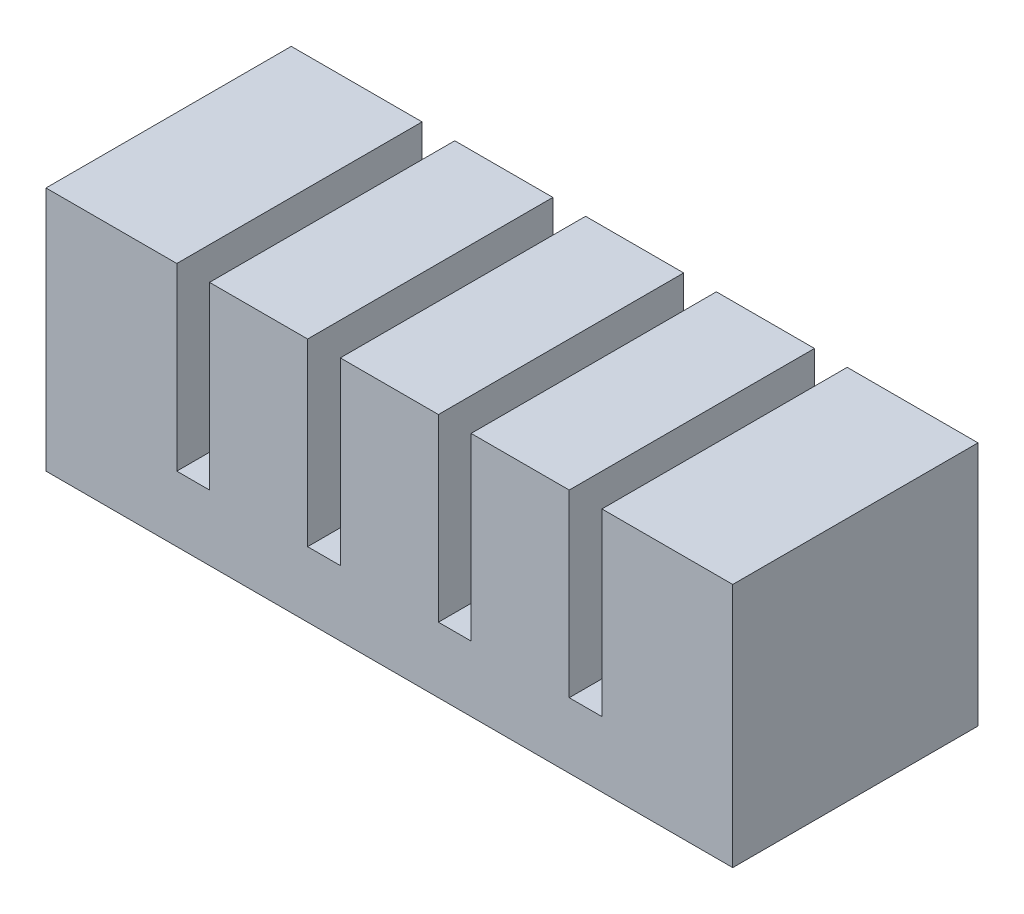
from build123d import *

# Parameters (mm, degrees)
SKETCH1_W           = 6
SKETCH1_H           = 15
BOSS_EXTRUDE1_DEPTH = 15
SKETCH2_W           = 4
SKETCH2_H           = 11
CUT_EXTRUDE1_DEPTH  = 13
SKETCH3_W           = 15
SKETCH3_H           = 4
BOSS_EXTRUDE2_DEPTH = 2
LPATTERN1_COUNT     = 4
LPATTERN1_PITCH     = 8
SKETCH4_W           = 15
SKETCH4_H           = 15
BOSS_EXTRUDE3_DEPTH = 8
SKETCH5_W           = 4
SKETCH5_H           = 11
CUT_EXTRUDE2_DEPTH  = 5.5
SKETCH6_W           = 15
SKETCH6_H           = 15
BOSS_EXTRUDE4_DEPTH = 2
SKETCH7_W           = 36
SKETCH7_H           = 2
CUT_EXTRUDE3_DEPTH  = 2


with BuildPart() as part:
    # Sketch1 → Boss-Extrude1 (new body)
    with BuildSketch(Plane(origin=(0, 0, 0), x_dir=(1, 0, 0), z_dir=(0, 1, 0))):
        with Locations((3, 7.5)):
            Rectangle(SKETCH1_W, SKETCH1_H)
    extrude(amount=BOSS_EXTRUDE1_DEPTH)

    # Sketch2 → Cut-Extrude1 (cut)
    with BuildSketch(Plane.XZ):
        with Locations((3, -7.5)):
            Rectangle(SKETCH2_W, SKETCH2_H)
    extrude(amount=-CUT_EXTRUDE1_DEPTH, mode=Mode.SUBTRACT)

    # Sketch3 → Boss-Extrude2 (add)
    with BuildSketch(Plane.ZY):
        with Locations((-7.5, 2)):
            Rectangle(SKETCH3_W, SKETCH3_H)
    extrude(amount=BOSS_EXTRUDE2_DEPTH)


with BuildPart() as lpattern1_1:
    # LPattern1: pattern copy
    add(part.part.moved(Location(Vector(-1, 0, 0) * (1 * LPATTERN1_PITCH))))


with BuildPart() as lpattern1_2:
    # LPattern1: pattern copy
    add(part.part.moved(Location(Vector(-1, 0, 0) * (2 * LPATTERN1_PITCH))))


with BuildPart() as lpattern1_3:
    # LPattern1: pattern copy
    add(part.part.moved(Location(Vector(-1, 0, 0) * (3 * LPATTERN1_PITCH))))

    # Sketch4 → Boss-Extrude3 (add)
    with BuildSketch(Plane.ZY.offset(26)):
        with Locations((-7.5, 7.5)):
            Rectangle(SKETCH4_W, SKETCH4_H)
    extrude(amount=BOSS_EXTRUDE3_DEPTH)

    # Sketch5 → Cut-Extrude2 (cut)
    with BuildSketch(Plane.XZ):
        with Locations((-29, -7.5)):
            Rectangle(SKETCH5_W, SKETCH5_H)
    extrude(amount=-CUT_EXTRUDE2_DEPTH, mode=Mode.SUBTRACT)


with BuildPart() as lpattern1_1_1:
    add(lpattern1_1.part)

    # Combine1: union LPattern1_2, LPattern1_3, part
    add(lpattern1_2.part)
    add(lpattern1_3.part)
    add(part.part)

    # Sketch6 → Boss-Extrude4 (add)
    with BuildSketch(Plane(origin=(6, 0, 0), x_dir=(0, 0, -1), z_dir=(1, 0, 0))):
        with Locations((7.5, 7.5)):
            Rectangle(SKETCH6_W, SKETCH6_H)
    extrude(amount=BOSS_EXTRUDE4_DEPTH)

    # Sketch7 → Cut-Extrude3 (cut)
    with BuildSketch(Plane.XZ):
        with Locations((-13, -7.5)):
            Rectangle(SKETCH7_W, SKETCH7_H)
    extrude(amount=-CUT_EXTRUDE3_DEPTH, mode=Mode.SUBTRACT)


solid = lpattern1_1_1.part
